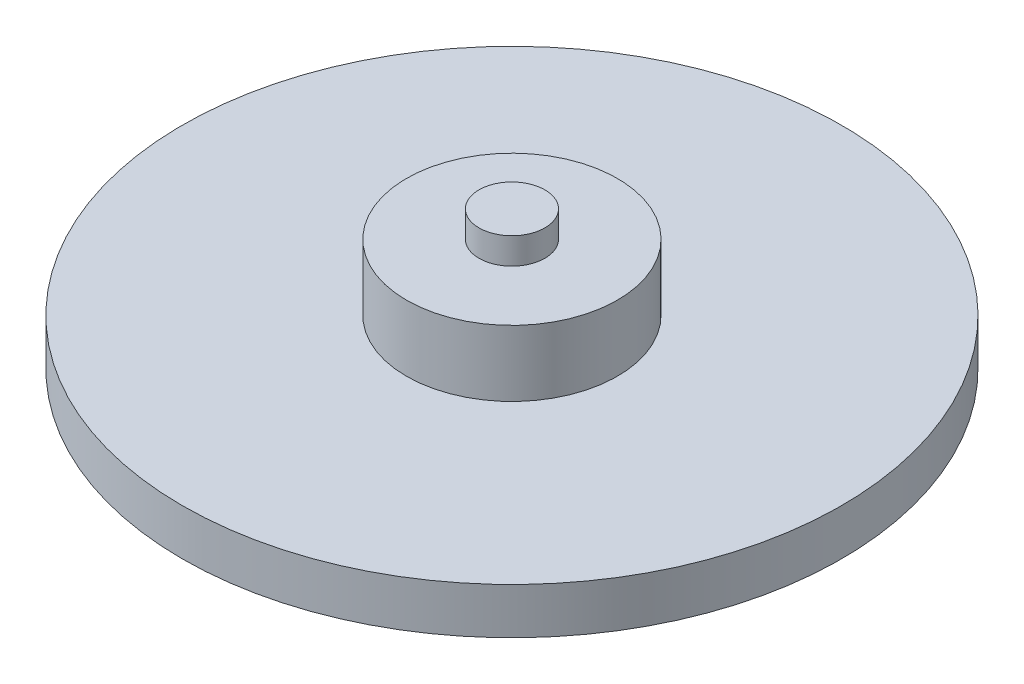
from build123d import *

# Parameters (mm, degrees)
SKETCH1_R           = 25
BOSS_EXTRUDE1_DEPTH = 3.5
SKETCH2_R           = 8
BOSS_EXTRUDE2_DEPTH = 5
SKETCH5_R           = 2.5
BOSS_EXTRUDE3_DEPTH = 2


with BuildPart() as part:
    # Sketch1 → Boss-Extrude1 (new body)
    with BuildSketch(Plane(origin=(0, 0, 0), x_dir=(1, 0, 0), z_dir=(0, 1, 0))):
        with Locations(Location((0, 0, 0), (0, 0, 270))):
            Circle(SKETCH1_R)
    extrude(amount=BOSS_EXTRUDE1_DEPTH)

    # Sketch2 → Boss-Extrude2 (add)
    with BuildSketch(Plane(origin=(0, 3.5, 0), x_dir=(1, 0, 0), z_dir=(0, 1, 0))):
        with Locations(Location((0, 0, 0), (0, 0, 270))):
            Circle(SKETCH2_R)
    extrude(amount=BOSS_EXTRUDE2_DEPTH)

    # Sketch5 → Boss-Extrude3 (add)
    with BuildSketch(Plane(origin=(0, 8.5, 0), x_dir=(1, 0, 0), z_dir=(0, 1, 0))):
        with Locations(Location((0, 0, 0), (0, 0, 270))):
            Circle(SKETCH5_R)
    extrude(amount=BOSS_EXTRUDE3_DEPTH)


solid = part.part
